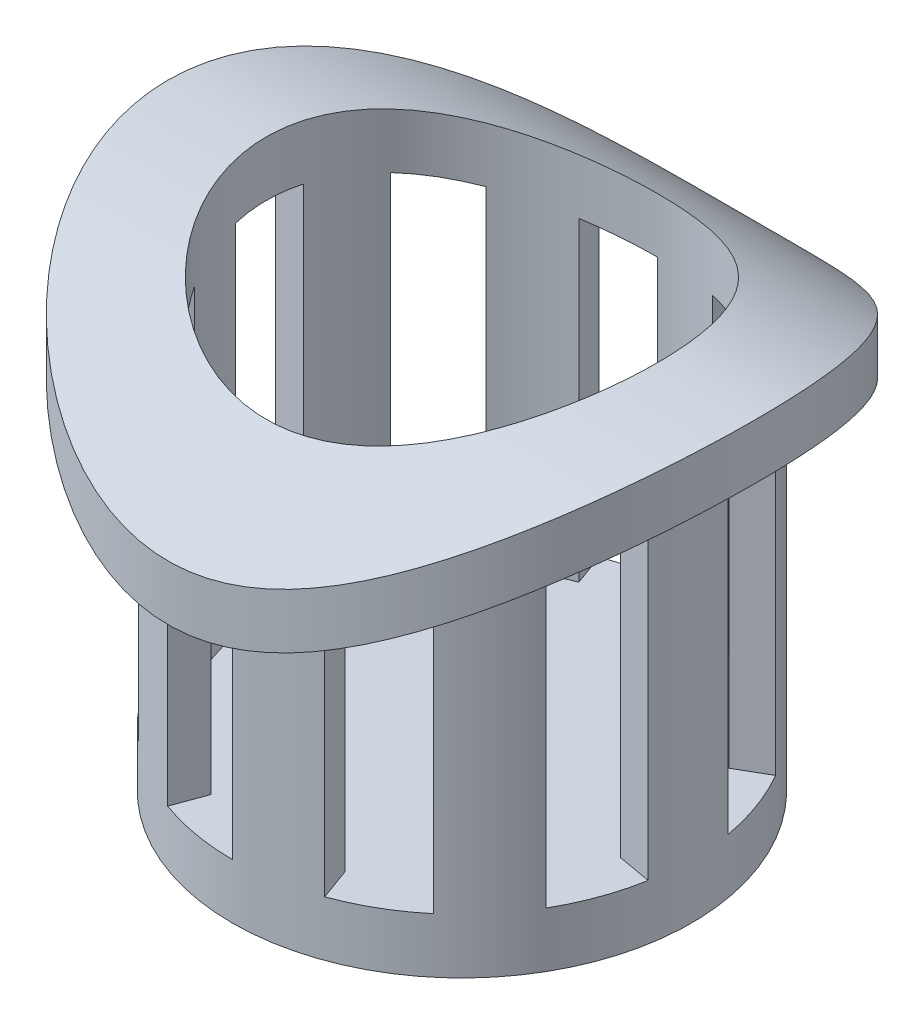
from build123d import *
from build123d.topology import SkipClean

# Parameters (mm, degrees)
SKETCH1_R               = 40.64
SKETCH1_R_2             = 27.051
BOSS_EXTRUDE1_DEPTH     = 101.6
CUT_EXTRUDE1_DEPTH      = 101.6
CUT_EXTRUDE1_DEPTH_BACK = 101.6
SKETCH2_R               = 57.15
SKETCH5_R               = 31.75
BOSS_EXTRUDE2_DEPTH     = 7.62
BOSS_EXTRUDE6_DEPTH     = 50.8
CUT_EXTRUDE2_DEPTH      = 101.6
CUT_EXTRUDE2_DEPTH_BACK = 101.6
SKETCH4_R               = 120.665754598
SKETCH4_R_2             = 57.15


with BuildPart() as part:
    # Sketch1 → Boss-Extrude1 (new body)
    with BuildSketch(Plane(origin=(0, 0, 0), x_dir=(1, 0, 0), z_dir=(0, 1, 0))):
        Circle(SKETCH1_R)
        Circle(SKETCH1_R_2, mode=Mode.SUBTRACT)
    extrude(amount=BOSS_EXTRUDE1_DEPTH)

    # Sketch2 → Cut-Extrude1 (cut, two sides: drawn at the far end of the back side and taken through both)
    with BuildSketch(Plane(origin=(0, 0, 0), x_dir=(0, 0, -1), z_dir=(1, 0, 0)).offset(-CUT_EXTRUDE1_DEPTH_BACK)):
        Circle(SKETCH2_R)
    extrude(amount=CUT_EXTRUDE1_DEPTH + CUT_EXTRUDE1_DEPTH_BACK, mode=Mode.SUBTRACT)



with BuildPart() as body_2:
    # Sketch5 → Boss-Extrude2 (new body)
    with BuildSketch(Plane(origin=(0, 0, 0), x_dir=(1, 0, 0), z_dir=(0, 1, 0))):
        Circle(SKETCH5_R)
    extrude(amount=BOSS_EXTRUDE2_DEPTH)


with BuildPart() as part_1:
    with SkipClean():  # the faces are left unmerged after this step: merging them gives an invalid solid
        add(part.part)

        add(body_2.part)  # Boss-Extrude6 merges body 2
        # Sketch11 → Boss-Extrude6 (add)
        with BuildSketch(Plane(origin=(0, 7.62, 0), x_dir=(1, 0, 0), z_dir=(0, 1, 0))):
            with BuildLine():
                Line((23.426853198, -13.5255), (27.49630657, -15.875))
                ThreePointArc((27.49630657, -15.875), (24.321911069, -20.408506608), (20.408506608, -24.321911069))
                Line((20.408506608, -24.321911069), (17.38804763, -20.722268231))
                ThreePointArc((17.38804763, -20.722268231), (20.722268231, -17.38804763), (23.426853198, -13.5255))
            make_face()
            with BuildLine():
                Line((26.640034527, 4.697356854), (31.267646158, 5.513329641))
                ThreePointArc((31.267646158, 5.513329641), (31.75, 0), (31.267646158, -5.513329641))
                Line((31.267646158, -5.513329641), (26.640034527, -4.697356854))
                ThreePointArc((26.640034527, -4.697356854), (27.051, 0), (26.640034527, 4.697356854))
            make_face()
            with BuildLine():
                Line((9.251986897, -25.419625085), (10.859139551, -29.83524071))
                ThreePointArc((10.859139551, -29.83524071), (5.513329641, -31.267646158), (0, -31.75))
                Line((0, -31.75), (0, -27.051))
                ThreePointArc((0, -27.051), (4.697356854, -26.640034527), (9.251986897, -25.419625085))
            make_face()
            with BuildLine():
                Line((-9.251986897, -25.419625085), (-10.859139551, -29.83524071))
                ThreePointArc((-10.859139551, -29.83524071), (-15.875, -27.49630657), (-20.408506608, -24.321911069))
                Line((-20.408506608, -24.321911069), (-17.38804763, -20.722268231))
                ThreePointArc((-17.38804763, -20.722268231), (-13.5255, -23.426853198), (-9.251986897, -25.419625085))
            make_face()
            with BuildLine():
                Line((-23.426853198, -13.5255), (-27.49630657, -15.875))
                ThreePointArc((-27.49630657, -15.875), (-29.83524071, -10.859139551), (-31.267646158, -5.513329641))
                Line((-31.267646158, -5.513329641), (-26.640034527, -4.697356854))
                ThreePointArc((-26.640034527, -4.697356854), (-25.419625085, -9.251986897), (-23.426853198, -13.5255))
            make_face()
            with BuildLine():
                Line((-26.640034527, 4.697356854), (-31.267646158, 5.513329641))
                ThreePointArc((-31.267646158, 5.513329641), (-29.83524071, 10.859139551), (-27.49630657, 15.875))
                Line((-27.49630657, 15.875), (-23.426853198, 13.5255))
                ThreePointArc((-23.426853198, 13.5255), (-25.419625085, 9.251986897), (-26.640034527, 4.697356854))
            make_face()
            with BuildLine():
                Line((-17.38804763, 20.722268231), (-20.408506608, 24.321911069))
                ThreePointArc((-20.408506608, 24.321911069), (-15.875, 27.49630657), (-10.859139551, 29.83524071))
                Line((-10.859139551, 29.83524071), (-9.251986897, 25.419625085))
                ThreePointArc((-9.251986897, 25.419625085), (-13.5255, 23.426853198), (-17.38804763, 20.722268231))
            make_face()
            with BuildLine():
                Line((0, 27.051), (0, 31.75))
                ThreePointArc((0, 31.75), (5.513329641, 31.267646158), (10.859139551, 29.83524071))
                Line((10.859139551, 29.83524071), (9.251986897, 25.419625085))
                ThreePointArc((9.251986897, 25.419625085), (4.697356854, 26.640034527), (0, 27.051))
            make_face()
            with BuildLine():
                Line((17.38804763, 20.722268231), (20.408506608, 24.321911069))
                ThreePointArc((20.408506608, 24.321911069), (24.321911069, 20.408506608), (27.49630657, 15.875))
                Line((27.49630657, 15.875), (23.426853198, 13.5255))
                ThreePointArc((23.426853198, 13.5255), (20.722268231, 17.38804763), (17.38804763, 20.722268231))
            make_face()
        extrude(amount=BOSS_EXTRUDE6_DEPTH)

    # Sketch4 → Cut-Extrude2 (cut, two sides: drawn at the far end of the back side and taken through both)
    with SkipClean():  # the faces are left unmerged after this step: merging them gives an invalid solid
        with BuildSketch(Plane(origin=(0, 0, 0), x_dir=(0, 0, -1), z_dir=(1, 0, 0)).offset(-CUT_EXTRUDE2_DEPTH_BACK)):
            Circle(SKETCH4_R)
            with Locations((0, 7.62)):
                Circle(SKETCH4_R_2, mode=Mode.SUBTRACT)
        extrude(amount=CUT_EXTRUDE2_DEPTH + CUT_EXTRUDE2_DEPTH_BACK, mode=Mode.SUBTRACT)


solid = part_1.part
